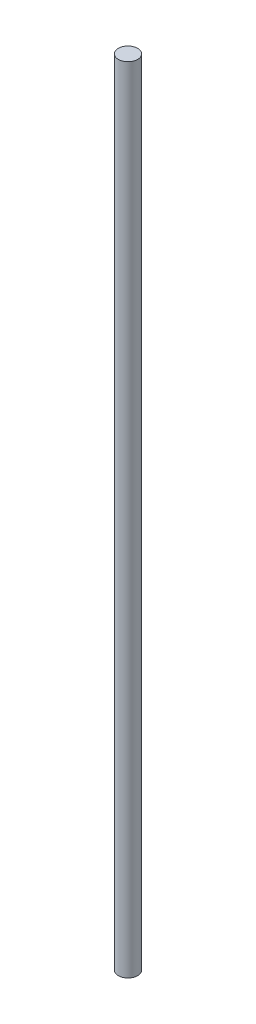
from build123d import *

# Parameters (mm, degrees)
SKETCH2_R           = 1.0795
BOSS_EXTRUDE1_DEPTH = 88.9


with BuildPart() as part:
    # Sketch2 → Boss-Extrude1 (new body)
    with BuildSketch(Plane(origin=(0, 0, 0), x_dir=(1, 0, 0), z_dir=(0, 1, 0))):
        with Locations(Location((0, 0, 0), (0, 0, 270))):
            Circle(SKETCH2_R)
    extrude(amount=BOSS_EXTRUDE1_DEPTH)


solid = part.part
